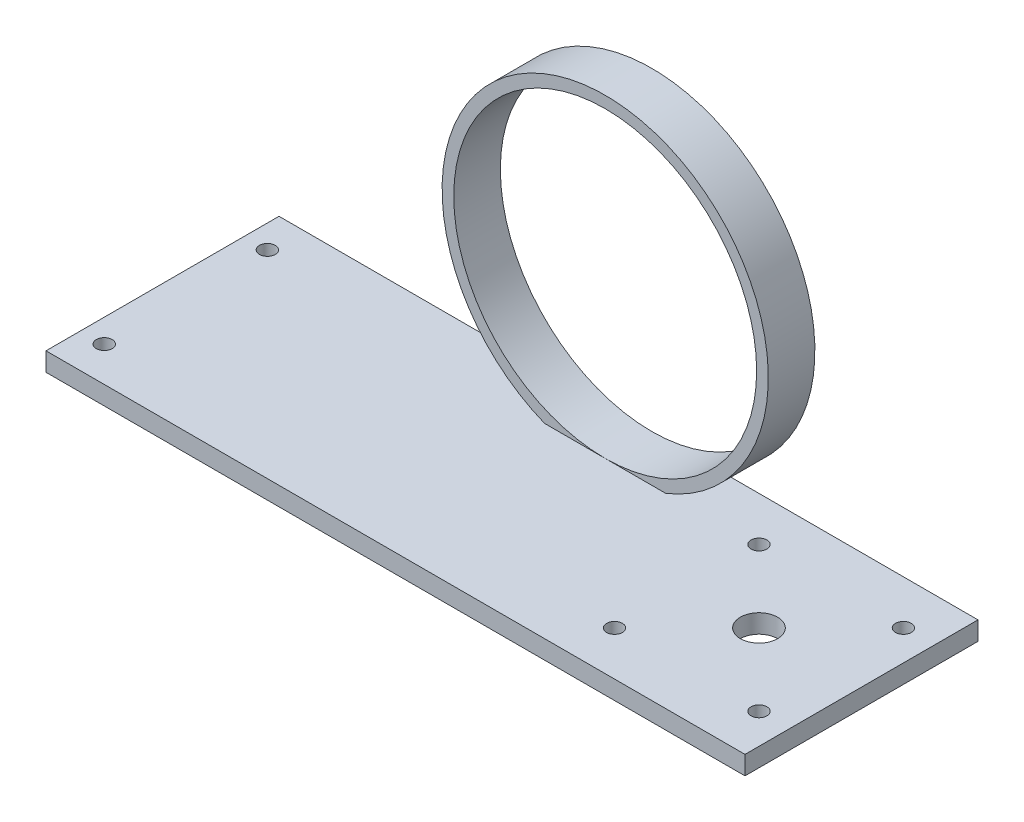
from build123d import *

# Parameters (mm, degrees)
SKETCH_1_R          = 35
SKETCH_1_R_2        = 32.5
EXTRUDE_1_DEPTH     = 10
EXTRUDE_2_DEPTH     = 50
CUT_EXTRUDE_1_REACH = 118.001
SKETCH_3_R          = 4
CUT_EXTRUDE_2_REACH = 120.373
SKETCH_4_R          = 1.7
CUT_EXTRUDE_3_REACH = 120.373
SKETCH_5_R          = 1.7


with BuildPart() as part:
    # ｽｹｯﾁ1 → ﾎﾞｽ - 押し出し1 (new body)
    with BuildSketch(Plane.XY):
        Circle(SKETCH_1_R)
        Circle(SKETCH_1_R_2, mode=Mode.SUBTRACT)
    extrude(amount=EXTRUDE_1_DEPTH)

    # ｽｹｯﾁ2 → ﾎﾞｽ - 押し出し2 (add)
    with BuildSketch(Plane(origin=(0, 0, 0), x_dir=(-1, 0, 0), z_dir=(0, 0, -1))):
        Polygon((0, -32.5), (-70, -32.5), (-70, -36.5), (80, -36.5), (80, -32.5), align=None)
    extrude(amount=-EXTRUDE_2_DEPTH)

    # ｽｹｯﾁ3 → ｶｯﾄ - 押し出し1 (cut, up to next)
    with BuildSketch(Plane(origin=(0, -32.5, 0), x_dir=(1, 0, 0), z_dir=(0, 1, 0)), mode=Mode.PRIVATE) as cut_extrude_1_sk1:
        with Locations(Location((48, -25, 0), (0, 0, 180))):
            Circle(SKETCH_3_R)
    cut_extrude_1_tool1 = extrude(cut_extrude_1_sk1.sketch, amount=-CUT_EXTRUDE_1_REACH, mode=Mode.PRIVATE) & part.part
    add(cut_extrude_1_tool1.solids().sort_by_distance((48, -32.5, 25))[0], mode=Mode.SUBTRACT)

    # ｽｹｯﾁ4 → ｶｯﾄ - 押し出し2 (cut, up to next)
    with BuildSketch(Plane.XZ.offset(36.5), mode=Mode.PRIVATE) as cut_extrude_2_sk1:
        with Locations(Location((63.5, 40.5, 0), (0, 0, 270))):
            Circle(SKETCH_4_R)
    cut_extrude_2_tool1 = extrude(cut_extrude_2_sk1.sketch, amount=-CUT_EXTRUDE_2_REACH, mode=Mode.PRIVATE) & part.part
    # ｽｹｯﾁ4 → ｶｯﾄ - 押し出し2 (cut, up to next)
    with BuildSketch(Plane.XZ.offset(36.5), mode=Mode.PRIVATE) as cut_extrude_2_sk2:
        with Locations(Location((63.5, 9.5, 0), (0, 0, 270))):
            Circle(SKETCH_4_R)
    cut_extrude_2_tool2 = extrude(cut_extrude_2_sk2.sketch, amount=-CUT_EXTRUDE_2_REACH, mode=Mode.PRIVATE) & part.part
    # ｽｹｯﾁ4 → ｶｯﾄ - 押し出し2 (cut, up to next)
    with BuildSketch(Plane.XZ.offset(36.5), mode=Mode.PRIVATE) as cut_extrude_2_sk3:
        with Locations(Location((32.5, 40.5, 0), (0, 0, 270))):
            Circle(SKETCH_4_R)
    cut_extrude_2_tool3 = extrude(cut_extrude_2_sk3.sketch, amount=-CUT_EXTRUDE_2_REACH, mode=Mode.PRIVATE) & part.part
    # ｽｹｯﾁ4 → ｶｯﾄ - 押し出し2 (cut, up to next)
    with BuildSketch(Plane.XZ.offset(36.5), mode=Mode.PRIVATE) as cut_extrude_2_sk4:
        with Locations(Location((32.5, 9.5, 0), (0, 0, 270))):
            Circle(SKETCH_4_R)
    cut_extrude_2_tool4 = extrude(cut_extrude_2_sk4.sketch, amount=-CUT_EXTRUDE_2_REACH, mode=Mode.PRIVATE) & part.part
    add(cut_extrude_2_tool1.solids().sort_by_distance((63.5, -36.5, 40.5))[0], mode=Mode.SUBTRACT)
    add(cut_extrude_2_tool2.solids().sort_by_distance((63.5, -36.5, 9.5))[0], mode=Mode.SUBTRACT)
    add(cut_extrude_2_tool3.solids().sort_by_distance((32.5, -36.5, 40.5))[0], mode=Mode.SUBTRACT)
    add(cut_extrude_2_tool4.solids().sort_by_distance((32.5, -36.5, 9.5))[0], mode=Mode.SUBTRACT)

    # ｽｹｯﾁ5 → ｶｯﾄ - 押し出し3 (cut, up to next)
    with BuildSketch(Plane.XZ.offset(36.5), mode=Mode.PRIVATE) as cut_extrude_3_sk1:
        with Locations(Location((-75, 42.5, 0), (0, 0, 270))):
            Circle(SKETCH_5_R)
    cut_extrude_3_tool1 = extrude(cut_extrude_3_sk1.sketch, amount=-CUT_EXTRUDE_3_REACH, mode=Mode.PRIVATE) & part.part
    # ｽｹｯﾁ5 → ｶｯﾄ - 押し出し3 (cut, up to next)
    with BuildSketch(Plane.XZ.offset(36.5), mode=Mode.PRIVATE) as cut_extrude_3_sk2:
        with Locations(Location((-75, 7.5, 0), (0, 0, 270))):
            Circle(SKETCH_5_R)
    cut_extrude_3_tool2 = extrude(cut_extrude_3_sk2.sketch, amount=-CUT_EXTRUDE_3_REACH, mode=Mode.PRIVATE) & part.part
    add(cut_extrude_3_tool1.solids().sort_by_distance((-75, -36.5, 42.5))[0], mode=Mode.SUBTRACT)
    add(cut_extrude_3_tool2.solids().sort_by_distance((-75, -36.5, 7.5))[0], mode=Mode.SUBTRACT)


solid = part.part
